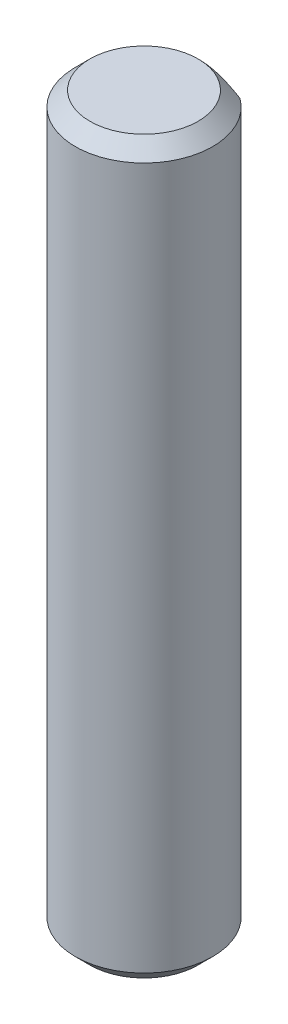
from build123d import *

# Parameters (mm, degrees)
CUT_EXTRUDE1_DEPTH = 26.219932593


with BuildPart() as part:
    # Sketch1 → Revolve1 (revolve)
    with BuildSketch(Plane.XY):
        Polygon((0, -12.5), (-1.85, -12.5), (-2.35, -12), (-2.35, 12), (-1.85, 12.5), (0, 12.5), align=None)
    revolve(axis=Axis((0, 12.5, 0), (0, -1, 0)))

    # Sketch2 → Cut-Extrude1 (cut, through all)
    with BuildSketch(Plane(origin=(0, 12.5, 0), x_dir=(1, 0, 0), z_dir=(0, 1, 0))):
        with BuildLine():
            ThreePointArc((1.382931669, 1.9), (0, 2.35), (-1.382931669, 1.9))
            Line((-1.382931669, 1.9), (1.382931669, 1.9))
        make_face()
    extrude(amount=-CUT_EXTRUDE1_DEPTH, mode=Mode.SUBTRACT)


solid = part.part
